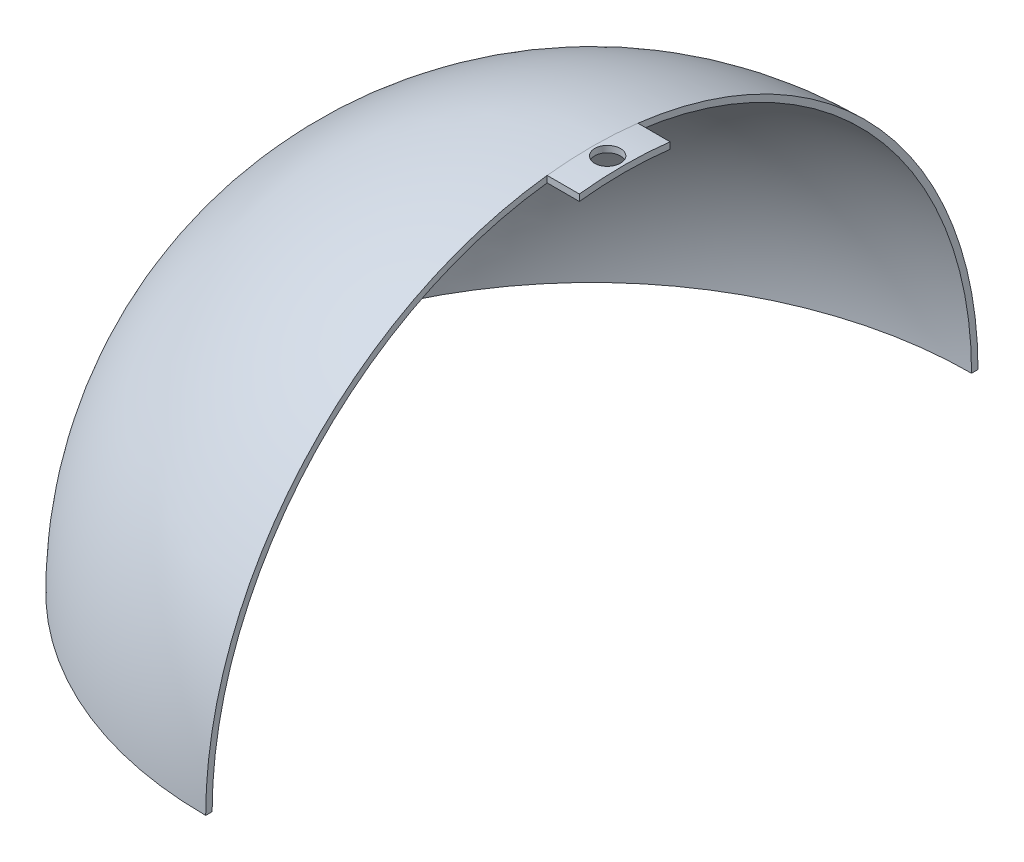
from build123d import *

# Parameters (mm, degrees)
REVOLVE1_ANGLE      = 90
BOSS_EXTRUDE1_DEPTH = 1000
SKETCH5_R           = 400
CUT_EXTRUDE1_DEPTH  = 1000


with BuildPart() as part:
    # Sketch2 → Revolve1 (revolve)
    with BuildSketch(Plane(origin=(0, 0, 0), x_dir=(1, 0, 0), z_dir=(0, 1, 0))):
        with BuildLine():
            Line((0, -12000), (0, -11800))
            ThreePointArc((0, -11800), (-11800, 0), (0, 11800))
            Line((0, 11800), (0, 12000))
            ThreePointArc((0, 12000), (-12000, 0), (0, -12000))
        make_face()
    revolve(axis=Axis((0, 0, 3077.152585208), (0, 0, -1)), revolution_arc=REVOLVE1_ANGLE)

    # Sketch4 → Boss-Extrude1 (add)
    with BuildSketch(Plane(origin=(0, 0, 0), x_dir=(0, 0, -1), z_dir=(1, 0, 0))):
        with BuildLine():
            Line((-1388.2785841, 11718.049435505), (-1388.2785841, 11919.424590681))
            ThreePointArc((-1388.2785841, 11919.424590681), (21.87293278, 11999.980065601), (1431.7214159, 11914.284442939))
            Line((1431.7214159, 11914.284442939), (1431.7214159, 11712.820915017))
            ThreePointArc((1431.7214159, 11712.820915017), (21.878168692, 11799.979718022), (-1388.2785841, 11718.049435505))
        make_face()
    extrude(amount=BOSS_EXTRUDE1_DEPTH)

    # Sketch5 → Cut-Extrude1 (cut)
    with BuildSketch(Plane(origin=(0, 12000, 0), x_dir=(1, 0, 0), z_dir=(0, 1, 0))):
        with Locations(Location((491.674267447, 0, 0), (0, 0, 270))):
            Circle(SKETCH5_R)
    extrude(amount=-CUT_EXTRUDE1_DEPTH, mode=Mode.SUBTRACT)


solid = part.part
